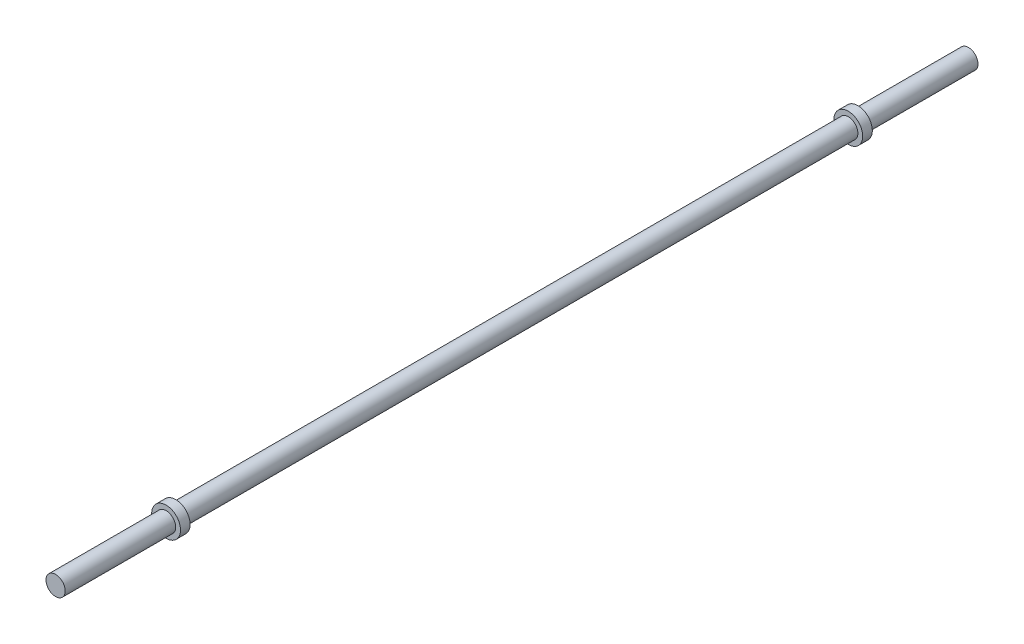
from build123d import *

# Parameters (mm, degrees)
SKETCH2_R           = 1
BOSS_EXTRUDE1_DEPTH = 95
BOSS_EXTRUDE2_START = -12.5
SKETCH3_R           = 1.5
BOSS_EXTRUDE2_DEPTH = 1
BOSS_EXTRUDE3_START = -11.5
SKETCH4_R           = 1.5
BOSS_EXTRUDE3_DEPTH = 1


with BuildPart() as part:
    # Sketch2 → Boss-Extrude1 (new body)
    with BuildSketch(Plane.XY):
        Circle(SKETCH2_R)
    extrude(amount=-BOSS_EXTRUDE1_DEPTH)

    # Sketch3 → Boss-Extrude2 (add)
    with BuildSketch(Plane.XY.offset(BOSS_EXTRUDE2_START)):
        Circle(SKETCH3_R)
    extrude(amount=BOSS_EXTRUDE2_DEPTH)

    # Sketch4 → Boss-Extrude3 (add)
    with BuildSketch(Plane(origin=(0, 0, -95), x_dir=(-1, 0, 0), z_dir=(0, 0, -1)).offset(BOSS_EXTRUDE3_START)):
        with Locations(Location((0, 0, 0), (0, 0, 180))):
            Circle(SKETCH4_R)
    extrude(amount=-BOSS_EXTRUDE3_DEPTH)


solid = part.part
